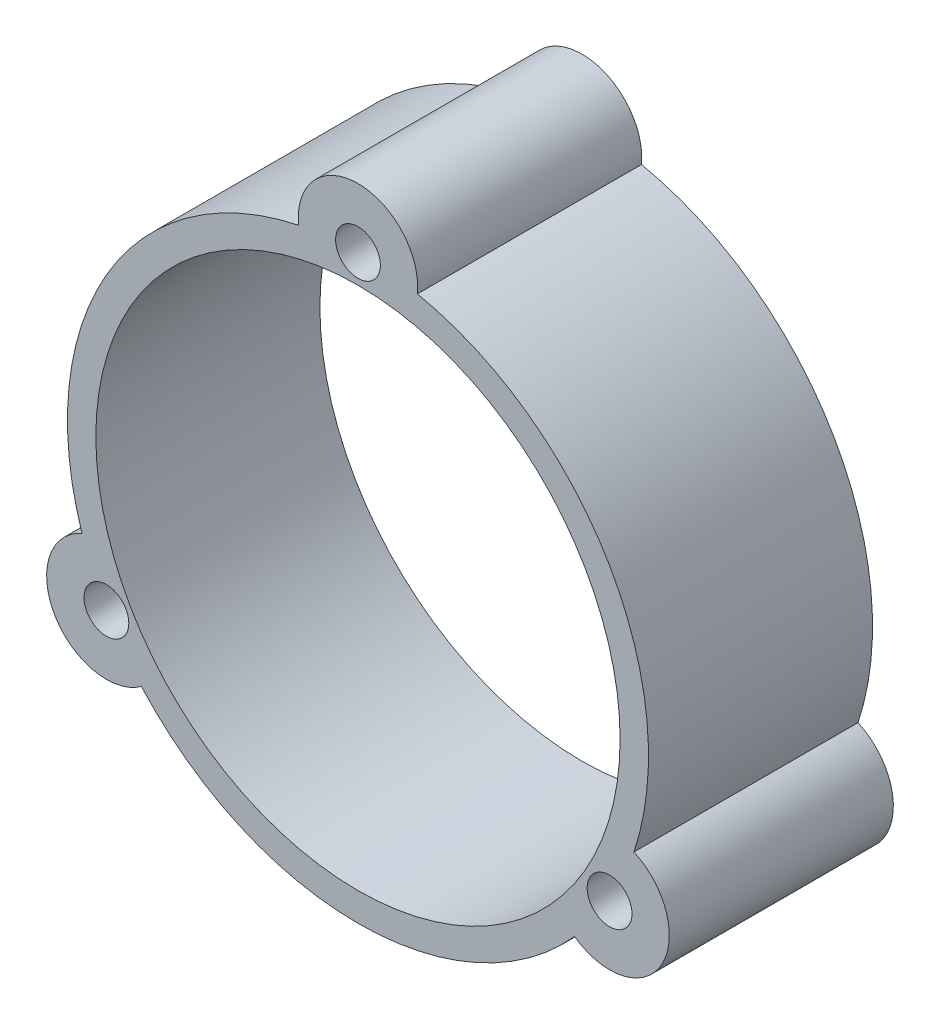
from build123d import *
from build123d.topology import SkipClean

# Parameters (mm, degrees)
ESQUISSE1_R                                = 19.45
ESQUISSE1_R_2                              = 17.55
BOSS_EXTRU_1_DEPTH                         = 15
ESQUISSE1_5_R                              = 1.5
ENL_V_MAT_EXTRU_1_DEPTH                    = 15
BOSS_EXTRU_2_DEPTH                         = 15
R_P_TITION_CIRCULAIRE1_COUNT               = 2
R_P_TITION_CIRCULAIRE1_ANGLE               = 120
R_P_TITION_CIRCULAIRE1_THE_OTHER_WAY_COUNT = 2
R_P_TITION_CIRCULAIRE1_THE_OTHER_WAY_ANGLE = 120


with BuildPart() as part:
    # Esquisse1 → Boss.-Extru.1 (new body)
    with BuildSketch(Plane.XY):
        Circle(ESQUISSE1_R)
        Circle(ESQUISSE1_R_2, mode=Mode.SUBTRACT)
    extrude(amount=BOSS_EXTRU_1_DEPTH)

    # Esquisse1<5> → Enlèv. mat.-Extru.1 (cut)
    with BuildSketch(Plane.XY):
        with Locations((0, 19.45)):
            Circle(ESQUISSE1_5_R)
    enl_v_mat_extru_1 = extrude(amount=ENL_V_MAT_EXTRU_1_DEPTH, mode=Mode.SUBTRACT)

    # Esquisse1<6> → Boss.-Extru.2 (add)
    with SkipClean():  # the faces are left unmerged after this step: merging them gives an invalid solid
        with BuildSketch(Plane.XY):
            with BuildLine():
                ThreePointArc((-1.498884406, 19.392159383), (-0.028925687, 20.949721076), (1.5, 19.45))
                ThreePointArc((1.5, 19.45), (1.499721076, 19.421074313), (1.498884406, 19.392159383))
                ThreePointArc((1.498884406, 19.392159383), (2.744536924, 19.255389299), (3.978796705, 19.038688946))
                ThreePointArc((3.978796705, 19.038688946), (3.994695659, 19.244071394), (4, 19.45))
                ThreePointArc((4, 19.45), (-0.205928606, 23.444695659), (-3.978796705, 19.038688946))
                ThreePointArc((-3.978796705, 19.038688946), (-2.744536924, 19.255389299), (-1.498884406, 19.392159383))
            make_face()
        boss_extru_2 = extrude(amount=BOSS_EXTRU_2_DEPTH)

    # Répétition circulaire1: Enlèv. mat.-Extru.1, Boss.-Extru.2 ×2 about axis
    with SkipClean():  # the faces are left unmerged after this step: merging them gives an invalid solid
        r_p_tition_circulaire1_axis = Axis((0, 0, 15), (0, 0, -1))
        add([enl_v_mat_extru_1.rotate(r_p_tition_circulaire1_axis, i * R_P_TITION_CIRCULAIRE1_ANGLE / (R_P_TITION_CIRCULAIRE1_COUNT - 1)) for i in range(1, R_P_TITION_CIRCULAIRE1_COUNT)], mode=Mode.SUBTRACT)
        add([boss_extru_2.rotate(r_p_tition_circulaire1_axis, i * R_P_TITION_CIRCULAIRE1_ANGLE / (R_P_TITION_CIRCULAIRE1_COUNT - 1)) for i in range(1, R_P_TITION_CIRCULAIRE1_COUNT)])

    # Répétition circulaire1 the other way: Enlèv. mat.-Extru.1, Boss.-Extru.2 ×2 about axis
    with SkipClean():  # the faces are left unmerged after this step: merging them gives an invalid solid
        r_p_tition_circulaire1_the_other_way_axis = Axis((0, 0, 15), (0, 0, 1))
        add([enl_v_mat_extru_1.rotate(r_p_tition_circulaire1_the_other_way_axis, i * R_P_TITION_CIRCULAIRE1_THE_OTHER_WAY_ANGLE / (R_P_TITION_CIRCULAIRE1_THE_OTHER_WAY_COUNT - 1)) for i in range(1, R_P_TITION_CIRCULAIRE1_THE_OTHER_WAY_COUNT)], mode=Mode.SUBTRACT)
        add([boss_extru_2.rotate(r_p_tition_circulaire1_the_other_way_axis, i * R_P_TITION_CIRCULAIRE1_THE_OTHER_WAY_ANGLE / (R_P_TITION_CIRCULAIRE1_THE_OTHER_WAY_COUNT - 1)) for i in range(1, R_P_TITION_CIRCULAIRE1_THE_OTHER_WAY_COUNT)])


solid = part.part
